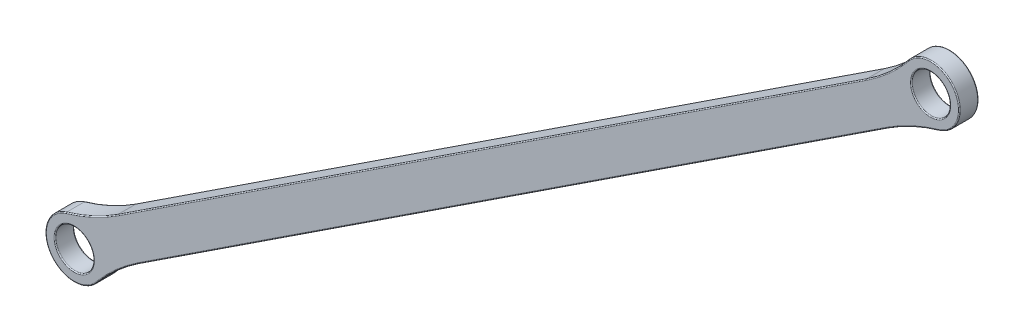
from build123d import *

# Parameters (mm, degrees)
BOSS_EXTRUDE1_DEPTH = 3
FILLET1_R           = 30
FILLET2_R           = 0.15


with BuildPart() as part:
    # Sketch1 → Boss-Extrude1 (new body)
    with BuildSketch(Plane.XY):
        with BuildLine():
            ThreePointArc((-86.628036754, 225.271869825), (-90.793972357, 229.759452802), (-95.578437189, 225.938155026))
            Line((-95.578437189, 225.938155026), (-92.774912725, 227.779418336))
            ThreePointArc((-92.774912725, 227.779418336), (-88.620488243, 226.918745795), (-89.481160784, 222.764321313))
            Line((-89.481160784, 222.764321313), (-92.284685248, 220.923058003))
            ThreePointArc((-92.284685248, 220.923058003), (-88.38531167, 221.704313363), (-86.628036754, 225.271869825))
        make_face()
        with BuildLine():
            Line((-92.774912725, 227.779418336), (-95.578437189, 225.938155026))
            ThreePointArc((-95.578437189, 225.938155026), (-94.889359522, 222.801555869), (-92.284685248, 220.923058003))
            Line((-92.284685248, 220.923058003), (-89.481160784, 222.764321313))
            ThreePointArc((-89.481160784, 222.764321313), (-93.635585266, 223.624993854), (-92.774912725, 227.779418336))
        make_face()
        with BuildLine():
            ThreePointArc((-223.217081393, 134.93093621), (-227.371505875, 135.79160875), (-226.510833335, 139.946033232))
            Line((-226.510833335, 139.946033232), (-223.70730887, 141.787296543))
            ThreePointArc((-223.70730887, 141.787296543), (-228.625280131, 134.968170765), (-220.413556929, 136.77219952))
            Line((-220.413556929, 136.77219952), (-223.217081393, 134.93093621))
        make_face()
        with BuildLine():
            Line((-223.70730887, 141.787296543), (-226.510833335, 139.946033232))
            ThreePointArc((-226.510833335, 139.946033232), (-222.356408852, 139.085360692), (-223.217081393, 134.93093621))
            Line((-223.217081393, 134.93093621), (-220.413556929, 136.77219952))
            ThreePointArc((-220.413556929, 136.77219952), (-220.376374386, 137.104420324), (-220.363957364, 137.438484721))
            ThreePointArc((-220.363957364, 137.438484721), (-221.296400902, 140.181209806), (-223.70730887, 141.787296543))
        make_face()
        with BuildLine():
            Line((-95.578437189, 225.938155026), (-223.70730887, 141.787296543))
            ThreePointArc((-223.70730887, 141.787296543), (-221.296400902, 140.181209806), (-220.363957364, 137.438484721))
            ThreePointArc((-220.363957364, 137.438484721), (-220.376374386, 137.104420324), (-220.413556929, 136.77219952))
            Line((-220.413556929, 136.77219952), (-92.284685248, 220.923058003))
            ThreePointArc((-92.284685248, 220.923058003), (-94.889359522, 222.801555869), (-95.578437189, 225.938155026))
        make_face()
    extrude(amount=-BOSS_EXTRUDE1_DEPTH)

    # Fillet1
    fillet1_edges = [part.edges().sort_by_distance(p)[0] for p in [
        (-95.578437189, 225.938155026, -1.5),
        (-92.284685248, 220.923058003, -1.5),
        (-220.413556929, 136.77219952, -1.5),
        (-223.70730887, 141.787296543, -1.5),
    ]]
    fillet(fillet1_edges, radius=FILLET1_R)

    # Fillet2
    fillet2_edges = [part.edges().sort_by_distance(p)[0] for p in [
        (-228.625280131, 134.968170765, 0),
        (-228.625280131, 134.968170765, -3),
        (-156.349121088, 178.847628761, 0),
        (-156.349121088, 178.847628761, -3),
        (-89.481160784, 222.764321313, -3),
        (-87.366713987, 227.742183781, 0),
        (-87.366713987, 227.742183781, -3),
        (-159.64287303, 183.862725784, 0),
        (-159.64287303, 183.862725784, -3),
        (-218.323694728, 137.752482748, 0),
        (-218.323694728, 137.752482748, -3),
        (-94.01456375, 219.394660282, 0),
        (-226.510833335, 139.946033232, -3),
        (-94.01456375, 219.394660282, -3),
        (-221.977430368, 143.315694264, 0),
        (-221.977430368, 143.315694264, -3),
        (-97.66829939, 224.957871798, 0),
        (-97.66829939, 224.957871798, -3),
        (-226.510833335, 139.946033232, 0),
        (-89.481160784, 222.764321313, 0),
    ]]
    fillet(fillet2_edges, radius=FILLET2_R)


solid = part.part
